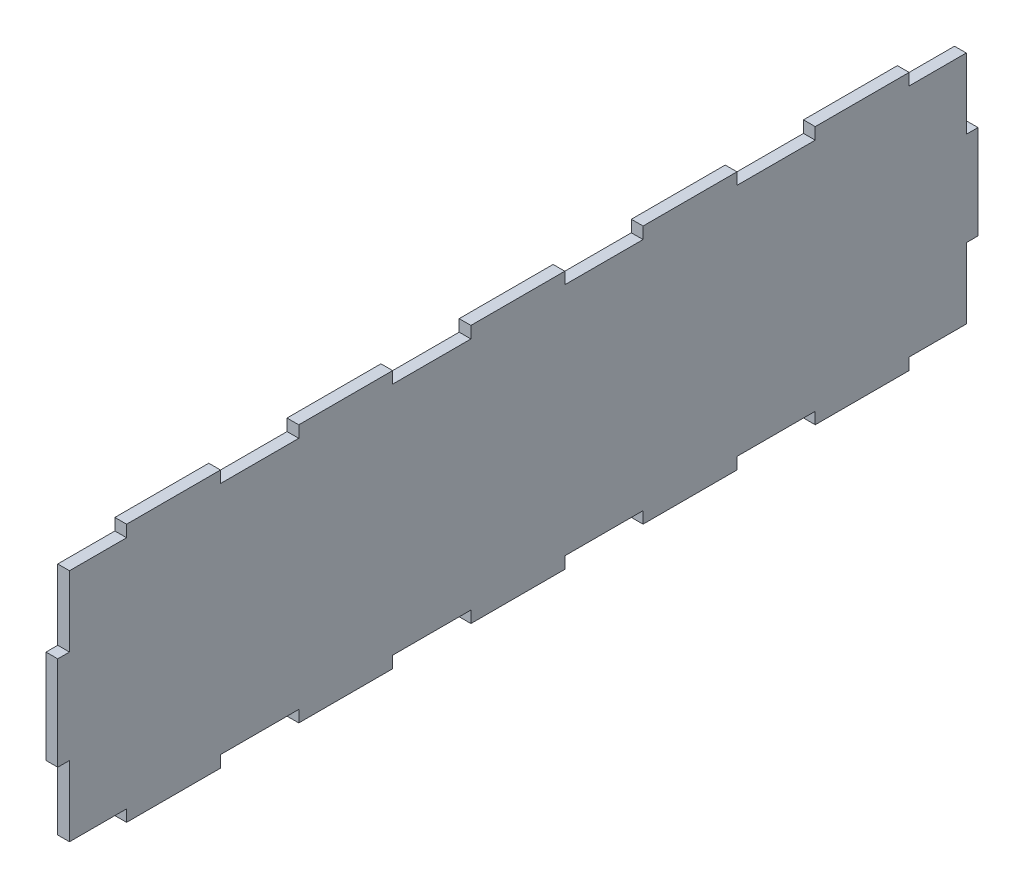
from build123d import *

# Parameters (mm, degrees)
BOSS_EXTRUDE1_DEPTH = 1.25


with BuildPart() as part:
    # Sketch1 → Boss-Extrude1 (new, symmetric)
    with BuildSketch(Plane(origin=(0, 0, 0), x_dir=(0, 0, -1), z_dir=(1, 0, 0))):
        Polygon((10, -27.5), (-10, -27.5), (-10, -25), (-26.666666667, -25), (-26.666666667, -27.5), (-46.666666667, -27.5), (-46.666666667, -25), (-63.333333333, -25), (-63.333333333, -27.5), (-83.333333333, -27.5), (-83.333333333, -25), (-95.5, -25), (-95.5, -10), (-98, -10), (-98, 10), (-95.5, 10), (-95.5, 25), (-83.333333333, 25), (-83.333333333, 27.5), (-63.333333333, 27.5), (-63.333333333, 25), (-46.666666667, 25), (-46.666666667, 27.5), (-26.666666667, 27.5), (-26.666666667, 25), (-10, 25), (-10, 27.5), (10, 27.5), (10, 25), (26.666666667, 25), (26.666666667, 27.5), (46.666666667, 27.5), (46.666666667, 25), (63.333333333, 25), (63.333333333, 27.5), (83.333333333, 27.5), (83.333333333, 25), (95.5, 25), (95.5, 10), (98, 10), (98, -10), (95.5, -10), (95.5, -25), (83.333333333, -25), (83.333333333, -27.5), (63.333333333, -27.5), (63.333333333, -25), (46.666666667, -25), (46.666666667, -27.5), (26.666666667, -27.5), (26.666666667, -25), (10, -25), align=None)
    extrude(amount=BOSS_EXTRUDE1_DEPTH, both=True)


solid = part.part
